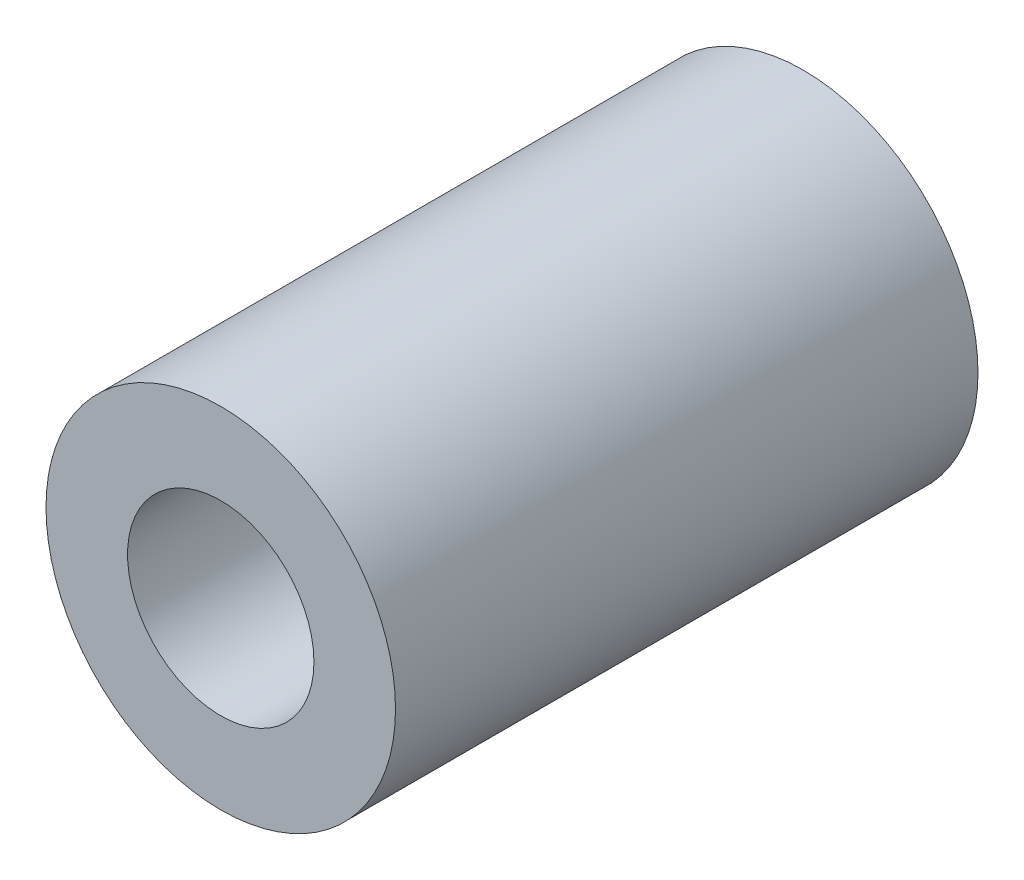
from build123d import *

# Parameters (mm, degrees)
SKETCH1_R      = 3
SKETCH1_R_2    = 1.6
EXTRUDE1_DEPTH = 5


with BuildPart() as part:
    # Sketch1 → Extrude1 (new, symmetric)
    with BuildSketch(Plane.XY):
        Circle(SKETCH1_R)
        Circle(SKETCH1_R_2, mode=Mode.SUBTRACT)
    extrude(amount=EXTRUDE1_DEPTH, both=True)


solid = part.part
